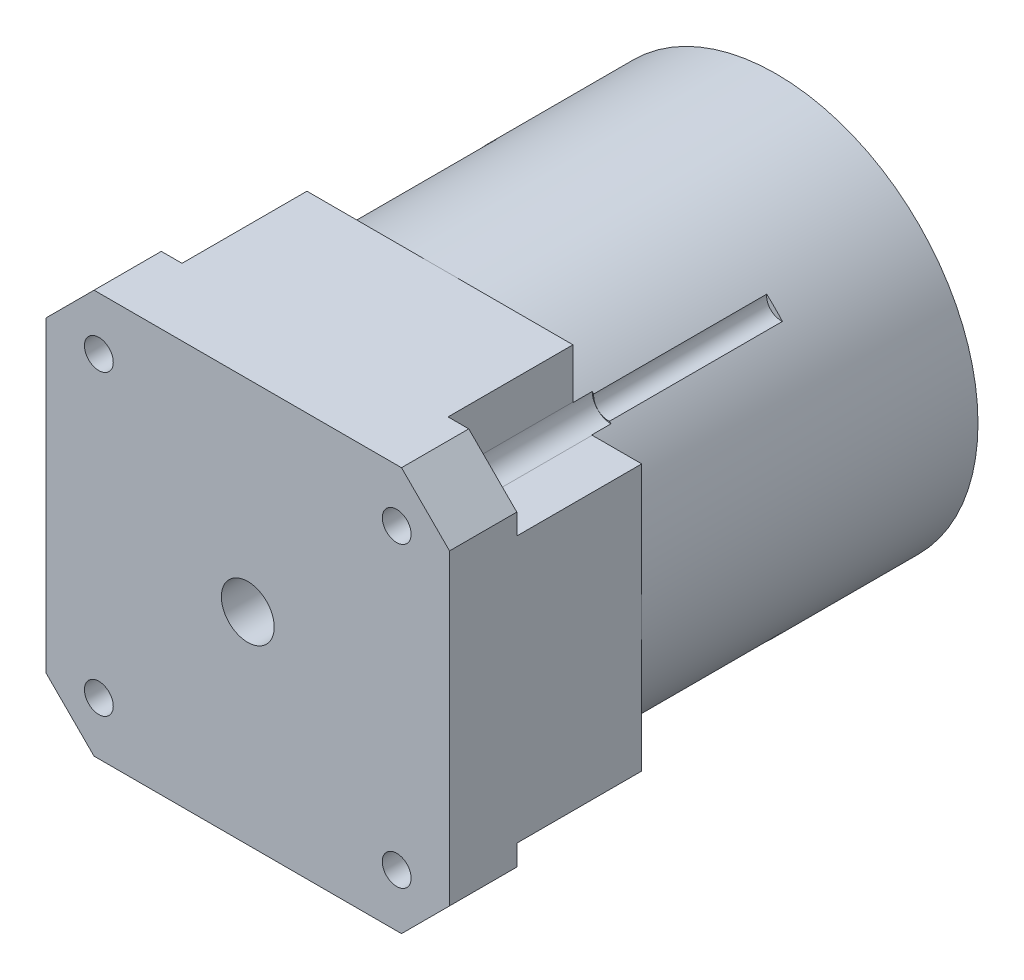
from build123d import *

# Parameters (mm, degrees)
SKETCH2_R               = 21
BOSS_EXTRUDE1_DEPTH     = 35
SKETCH3_W               = 42
SKETCH3_H               = 42
BOSS_EXTRUDE2_DEPTH     = 20
CHAMFER1_SIZE           = 5
CUT_EXTRUDE1_DEPTH      = 20
CUT_EXTRUDE1_DEPTH_BACK = 46.90206967
SKETCH4_R               = 1.5
CUT_EXTRUDE2_START      = 2
CUT_EXTRUDE2_DEPTH      = 15
SKETCH6_R               = 2.75
CUT_EXTRUDE3_DEPTH      = 63.505999712
SKETCH8_R               = 2
CUT_EXTRUDE4_DEPTH      = 8
BOSS_EXTRUDE3_START     = 2
SKETCH9_R               = 9.628132553
SKETCH9_R_2             = 2.75
BOSS_EXTRUDE3_DEPTH     = 2


with BuildPart() as part:
    # Sketch2 → Boss-Extrude1 (new body)
    with BuildSketch(Plane.XY):
        Circle(SKETCH2_R)
    extrude(amount=BOSS_EXTRUDE1_DEPTH)

    # Sketch3 → Boss-Extrude2 (add)
    with BuildSketch(Plane.XY.offset(35)):
        Rectangle(SKETCH3_W, SKETCH3_H)
    extrude(amount=BOSS_EXTRUDE2_DEPTH)

    # Chamfer1
    chamfer1_edges = [part.edges().sort_by_distance(p)[0] for p in [
        (-21, -21, 45),
        (21, -21, 45),
        (21, 21, 45),
        (-21, 21, 45),
    ]]
    chamfer(chamfer1_edges, length=CHAMFER1_SIZE)

    # Sketch4 → Cut-Extrude1 (cut, two sides: drawn at the far end of the back side and taken through both)
    with BuildSketch(Plane(origin=(0, 0, 35), x_dir=(-1, 0, 0), z_dir=(0, 0, -1)).offset(-CUT_EXTRUDE1_DEPTH_BACK)):
        with Locations(Location((15.5, 15.5, 0), (0, 0, 174.410746944))):
            Circle(SKETCH4_R)
        with Locations(Location((-15.5, 15.5, 0), (0, 0, 180))):
            Circle(SKETCH4_R)
        with Locations(Location((15.5, -15.5, 0), (0, 0, 180))):
            Circle(SKETCH4_R)
        with Locations(Location((-15.5, -15.5, 0), (0, 0, 95.589253056))):
            Circle(SKETCH4_R)
    extrude(amount=CUT_EXTRUDE1_DEPTH + CUT_EXTRUDE1_DEPTH_BACK, mode=Mode.SUBTRACT)

    # Sketch5 → Cut-Extrude2 (cut)
    with BuildSketch(Plane(origin=(0, 0, 35), x_dir=(-1, 0, 0), z_dir=(0, 0, -1)).offset(CUT_EXTRUDE2_START)):
        with BuildLine():
            Line((15.843578324, 13.843578324), (23.156421676, 13.843578324))
            Line((23.156421676, 13.843578324), (23.156421676, 23.156421676))
            Line((23.156421676, 23.156421676), (13.843578324, 23.156421676))
            Line((13.843578324, 23.156421676), (13.843578324, 15.843578324))
            ThreePointArc((13.843578324, 15.843578324), (14.429364762, 14.429364762), (15.843578324, 13.843578324))
        make_face()
        with BuildLine():
            Line((23.156421676, -13.843578324), (23.156421676, -23.156421676))
            Line((23.156421676, -23.156421676), (13.843578324, -23.156421676))
            Line((13.843578324, -23.156421676), (13.843578324, -15.843578324))
            ThreePointArc((13.843578324, -15.843578324), (14.429364762, -14.429364762), (15.843578324, -13.843578324))
            Line((15.843578324, -13.843578324), (23.156421676, -13.843578324))
        make_face()
        with BuildLine():
            Line((-23.156421676, 13.843578324), (-23.156421676, 23.156421676))
            Line((-23.156421676, 23.156421676), (-13.843578324, 23.156421676))
            Line((-13.843578324, 23.156421676), (-13.843578324, 15.843578324))
            ThreePointArc((-13.843578324, 15.843578324), (-14.429364762, 14.429364762), (-15.843578324, 13.843578324))
            Line((-15.843578324, 13.843578324), (-23.156421676, 13.843578324))
        make_face()
        with BuildLine():
            Line((-15.843578324, -13.843578324), (-23.156421676, -13.843578324))
            Line((-23.156421676, -13.843578324), (-23.156421676, -23.156421676))
            Line((-23.156421676, -23.156421676), (-13.843578324, -23.156421676))
            Line((-13.843578324, -23.156421676), (-13.843578324, -15.843578324))
            ThreePointArc((-13.843578324, -15.843578324), (-14.429364762, -14.429364762), (-15.843578324, -13.843578324))
        make_face()
    extrude(amount=-CUT_EXTRUDE2_DEPTH, mode=Mode.SUBTRACT)

    # Sketch6 → Cut-Extrude3 (cut, through all)
    with BuildSketch(Plane(origin=(0, 0, 0), x_dir=(-1, 0, 0), z_dir=(0, 0, -1))):
        Circle(SKETCH6_R)
    extrude(amount=-CUT_EXTRUDE3_DEPTH, mode=Mode.SUBTRACT)

    # Sketch8 → Cut-Extrude4 (cut)
    with BuildSketch(Plane(origin=(0, 0, 0), x_dir=(-1, 0, 0), z_dir=(0, 0, -1))):
        with Locations((0, 17.5)):
            Circle(SKETCH8_R)
        with Locations((17.5, 0)):
            Circle(SKETCH8_R)
        with Locations((0, -17.5)):
            Circle(SKETCH8_R)
        with Locations((-17.5, 0)):
            Circle(SKETCH8_R)
    extrude(amount=-CUT_EXTRUDE4_DEPTH, mode=Mode.SUBTRACT)

    # Sketch9 → Boss-Extrude3 (add)
    with BuildSketch(Plane(origin=(0, 0, 0), x_dir=(-1, 0, 0), z_dir=(0, 0, -1)).offset(BOSS_EXTRUDE3_START)):
        with Locations(Location((0, 0, 0), (0, 0, 180))):
            Circle(SKETCH9_R)
        Circle(SKETCH9_R_2, mode=Mode.SUBTRACT)
    extrude(amount=-BOSS_EXTRUDE3_DEPTH)


solid = part.part
